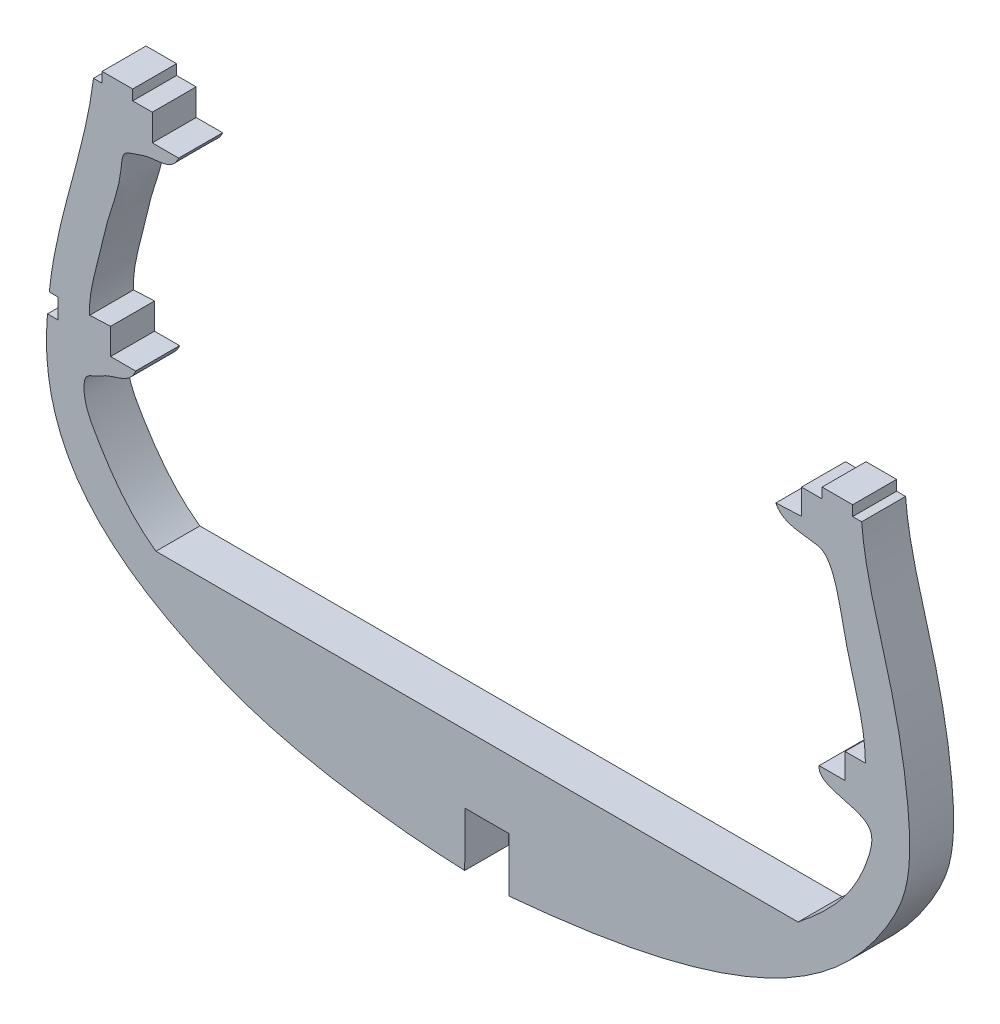
from build123d import *

# Parameters (mm, degrees)
EXTRUDE_1_DEPTH = 8


with BuildPart() as part:
    # 草图1 → 凸台-拉伸1 (new body)
    with BuildSketch(Plane.XY):
        with BuildLine():
            Line((1355.24330121, -740.452793078), (1238.291833943, -740.452793078))
            add(Edge.make_bspline(
                [(1238.291833943, -740.452793078), (1233.689879401, -737.212882689), (1228.980477618, -730.741250872), (1224.8440429, -723.046596284), (1225.405937622, -718.907471932), (1227.463260768, -718.381620922), (1230.283826997, -716.403182688), (1233.559239125, -716.51900184), (1234.598537372, -713.867104344)],
                knots=[0, 0, 0, 0, 0.45938999, 0.659456454, 0.71084301, 0.767464477, 0.814990837, 1, 1, 1, 1], degree=3))
            Line((1234.598537372, -713.867104344), (1230.040075123, -713.867104344))
            Line((1230.040075123, -713.867104344), (1230.040075123, -709.09589289))
            Line((1230.040075123, -709.09589289), (1226.222250434, -709.26573514))
            add(Edge.make_bspline(
                [(1226.222250434, -709.26573514), (1226.046323038, -705.623423946), (1227.816530462, -700.265774041), (1229.599951415, -691.437260809), (1231.950858473, -686.039377652), (1232.093228592, -680.328253457), (1234.618114616, -679.718133257), (1237.88464285, -678.364284073), (1241.26659321, -679.144619211), (1242.4344187, -676.372259606)],
                knots=[0, 0, 0, 0, 0.268047499, 0.41543553, 0.662017442, 0.730187644, 0.783122606, 0.83235203, 1, 1, 1, 1], degree=3))
            Line((1242.4344187, -676.372259606), (1237.624808781, -676.372259606))
            Line((1237.624808781, -676.372259606), (1237.624808781, -671.533535632))
            Line((1237.624808781, -671.533535632), (1234.058131763, -671.533535632))
            Line((1234.058131763, -671.533535632), (1234.058131763, -669.660986678))
            Line((1234.058131763, -669.660986678), (1228.491953992, -669.660986678))
            Line((1228.491953992, -669.660986678), (1228.491953992, -671.533535632))
            Line((1228.491953992, -671.533535632), (1226.924777726, -671.533535632))
            add(Edge.make_bspline(
                [(1226.924777726, -671.533535632), (1225.377656526, -684.360130196), (1220.146443403, -696.370270117), (1218.872734154, -709.26573514)],
                knots=[0, 0, 0, 0, 1, 1, 1, 1], degree=3))
            Line((1218.872734154, -709.26573514), (1220.421123546, -709.26573514))
            Line((1220.421123546, -709.26573514), (1220.421123546, -712.888962781))
            Line((1220.421123546, -712.888962781), (1218.536146864, -712.888962781))
            add(Edge.make_bspline(
                [(1294.53079088, -762.69274423), (1282.239300267, -762.210707593), (1263.261189746, -759.956821852), (1229.168524501, -746.32169642), (1216.733952557, -733.264175362), (1218.536146864, -712.888962781)],
                knots=[0, 0, 0, 0, 0.317060118, 0.385170059, 1, 1, 1, 1], degree=3))
            Line((1294.53079088, -762.69274423), (1294.586828296, -752.834729184))
            Line((1294.586828296, -752.834729184), (1302.588990627, -752.834729184))
            Line((1302.588990627, -752.834729184), (1302.588990627, -762.69274423))
            add(Edge.make_bspline(
                [(1366.824522024, -671.533535632), (1367.430525307, -679.35263569), (1372.074616406, -692.788319682), (1375.624333503, -711.156068972), (1375.862248993, -724.730693065), (1370.894034202, -734.435537349), (1360.855550617, -747.477348493), (1336.644453989, -758.745706643), (1313.381873631, -761.699780141), (1302.588990627, -762.69274423)],
                knots=[0, 0, 0, 0, 0.162515669, 0.293754001, 0.392890198, 0.434798192, 0.51882262, 0.731439242, 0.974989161, 0.974989161, 0.974989161, 0.974989161], degree=3))
            Line((1366.824522024, -671.533535632), (1365.189004584, -671.533535632))
            Line((1365.189004584, -671.533535632), (1365.189004584, -669.660986678))
            Line((1365.189004584, -669.660986678), (1359.618764024, -669.660986678))
            Line((1359.618764024, -669.660986678), (1359.618764024, -671.533535632))
            Line((1359.618764024, -671.533535632), (1355.873666116, -671.533535632))
            Line((1355.873666116, -671.533535632), (1355.873666116, -676.155650138))
            Line((1355.873666116, -676.155650138), (1351.197119238, -676.372259606))
            add(Edge.make_bspline(
                [(1367.513619087, -709.26573514), (1367.318070201, -702.137109963), (1364.199855253, -696.087230484), (1361.74708079, -679.61887935), (1358.267315006, -679.198349436), (1355.360307113, -678.792663809), (1352.193383637, -678.545927387), (1351.197119238, -676.372259606)],
                knots=[0, 0, 0, 0, 0.446994262, 0.733623696, 0.768819383, 0.798951139, 1, 1, 1, 1], degree=3))
            Line((1367.513619087, -709.26573514), (1363.806960562, -709.26573514))
            Line((1363.806960562, -709.26573514), (1363.806960562, -713.867104344))
            Line((1363.806960562, -713.867104344), (1359.077775547, -713.867104344))
            add(Edge.make_bspline(
                [(1355.24330121, -740.452793078), (1360.918424862, -735.886296992), (1366.563453485, -730.461106971), (1370.037490921, -716.237467329), (1358.747573091, -717.275659732), (1359.077775547, -713.867104344)],
                knots=[0, 0, 0, 0, 0.579254009, 0.707642249, 1, 1, 1, 1], degree=3))
        make_face()
    extrude(amount=EXTRUDE_1_DEPTH)


solid = part.part
